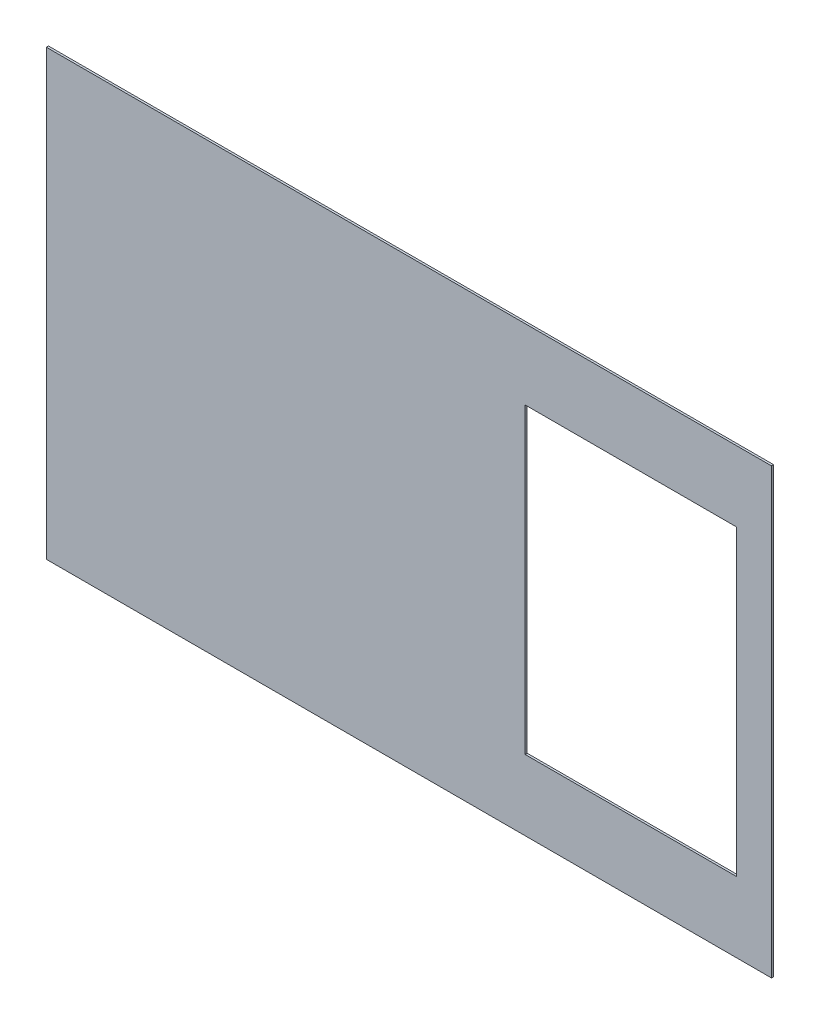
from build123d import *

# Parameters (mm, degrees)
ESQUISSE1_W             = 1030
ESQUISSE1_H             = 630
BOSS_EXTRU_1_DEPTH      = 3
ESQUISSE2_W             = 300
ESQUISSE2_H             = 430
ENL_V_MAT_EXTRU_1_DEPTH = 10


with BuildPart() as part:
    # Esquisse1 → Boss.-Extru.1 (new body)
    with BuildSketch(Plane.XY):
        Rectangle(ESQUISSE1_W, ESQUISSE1_H)
    extrude(amount=BOSS_EXTRU_1_DEPTH)

    # Esquisse2 → Enlèv. mat.-Extru.1 (cut)
    with BuildSketch(Plane(origin=(0, 0, 0), x_dir=(-1, 0, 0), z_dir=(0, 0, -1))):
        with Locations((-315, 0)):
            Rectangle(ESQUISSE2_W, ESQUISSE2_H)
    extrude(amount=-ENL_V_MAT_EXTRU_1_DEPTH, mode=Mode.SUBTRACT)


solid = part.part
